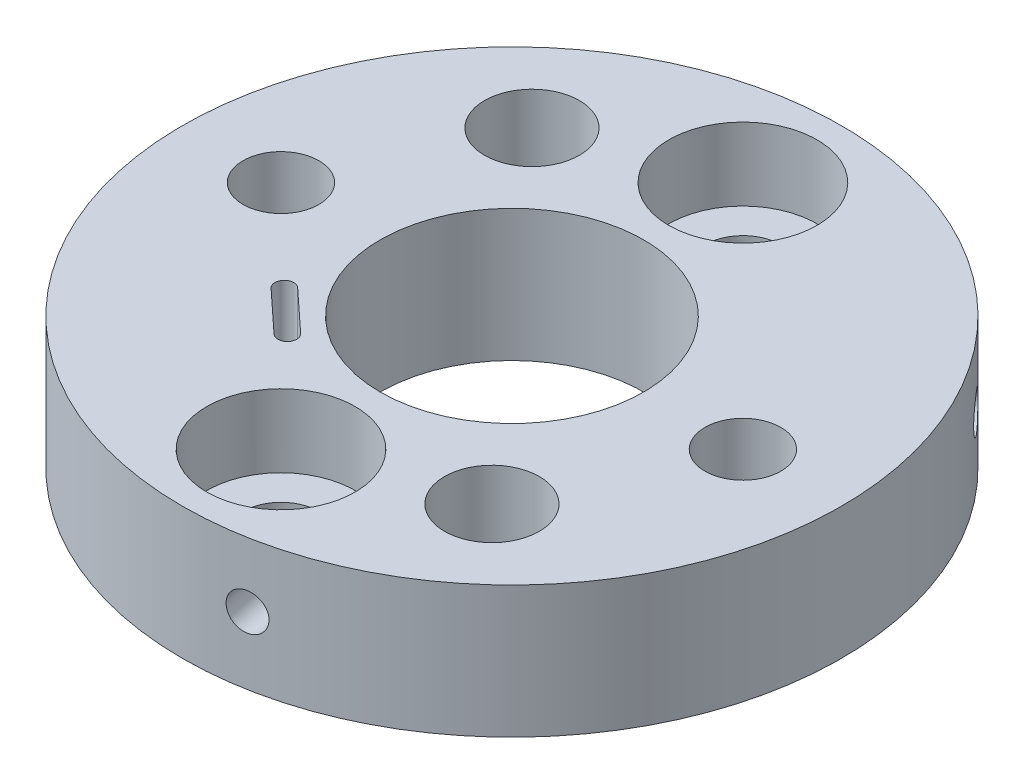
from build123d import *

# Parameters (mm, degrees)
SKETCH1_R                                      = 15.875
BOSS_EXTRUDE1_DEPTH                            = 6.35
SKETCH2_R                                      = 6.35
CUT_EXTRUDE1_DEPTH                             = 24.3313898
CBORE_FOR_6_SOCKET_HEAD_CAP_SCREW1_D           = 3.6576
CBORE_FOR_6_SOCKET_HEAD_CAP_SCREW1_CBORE_D     = 7.14502
CBORE_FOR_6_SOCKET_HEAD_CAP_SCREW1_CBORE_DEPTH = 3.5052
CIRPATTERN1_COUNT                              = 2
SKETCH11_R                                     = 2.286
CUT_EXTRUDE2_DEPTH                             = 24.3313898
CIRPATTERN3_COUNT                              = 2
CIRPATTERN4_COUNT                              = 3
CUT_EXTRUDE3_DEPTH                             = 24.331389963
CBORE_FOR_6_SOCKET_HEAD_CAP_SCREW2_D           = 3.6576
CBORE_FOR_6_SOCKET_HEAD_CAP_SCREW2_CBORE_D     = 7.14502
CBORE_FOR_6_SOCKET_HEAD_CAP_SCREW2_CBORE_DEPTH = 3.5052
CIRPATTERN5_COUNT                              = 2


with BuildPart() as part:
    # Sketch1 → Boss-Extrude1 (new body)
    with BuildSketch(Plane(origin=(0, 0, 0), x_dir=(1, 0, 0), z_dir=(0, 1, 0))):
        with Locations(Location((0, 0, 0), (0, 0, 270))):
            Circle(SKETCH1_R)
    extrude(amount=BOSS_EXTRUDE1_DEPTH)

    # Sketch2 → Cut-Extrude1 (cut, through all)
    with BuildSketch(Plane(origin=(0, 6.35, 0), x_dir=(1, 0, 0), z_dir=(0, 1, 0))):
        with Locations(Location((0, 0, 0), (0, 0, 270))):
            Circle(SKETCH2_R)
    extrude(amount=-CUT_EXTRUDE1_DEPTH, mode=Mode.SUBTRACT)

    # CBORE for #6 Socket Head Cap Screw1 (through all)
    with Locations(Plane(origin=(0, 6.35, 0), x_dir=(1, 0, 0), z_dir=(0, 1, 0))):
        with Locations((0, 11.1252)):
            cbore_for_6_socket_head_cap_screw1 = CounterBoreHole(CBORE_FOR_6_SOCKET_HEAD_CAP_SCREW1_D / 2, CBORE_FOR_6_SOCKET_HEAD_CAP_SCREW1_CBORE_D / 2, CBORE_FOR_6_SOCKET_HEAD_CAP_SCREW1_CBORE_DEPTH)

    # CirPattern1: CBORE for #6 Socket Head Cap Screw1 ×2 about axis
    cirpattern1_axis = Axis((0, 0, 0), (0, 1, 0))
    for i in range(1, CIRPATTERN1_COUNT):
        add(cbore_for_6_socket_head_cap_screw1.rotate(cirpattern1_axis, i * 360 / CIRPATTERN1_COUNT), mode=Mode.SUBTRACT)

    # Sketch11 → Cut-Extrude2 (cut, through all)
    with BuildSketch(Plane(origin=(0, 6.35, 0), x_dir=(1, 0, 0), z_dir=(0, 1, 0))):
        with Locations(Location((-7.360856908, 8.324988999, 0), (0, 0, 270))):
            Circle(SKETCH11_R)
    cut_extrude2 = extrude(amount=-CUT_EXTRUDE2_DEPTH, mode=Mode.SUBTRACT)

    # CirPattern3: Cut-Extrude2 ×2 about axis
    cirpattern3_axis = Axis((0, 0, 0), (0, 1, 0))
    for i in range(1, CIRPATTERN3_COUNT):
        add(cut_extrude2.rotate(cirpattern3_axis, i * 360 / CIRPATTERN3_COUNT), mode=Mode.SUBTRACT)

    # Sketch16 → Tap Drill for #2-56 Tap3 (revolve, cut)
    with BuildSketch(Plane(origin=(12.093135875, 3.244987275, -10.284536436), x_dir=(-0.6478448148472237, 0, -0.7617723386127685), z_dir=(0, 1, 0))):
        Polygon((0, 0), (0, 7.095959572), (0.889, 6.35), (0.889, 0), align=None)
    tap_drill_for_2_56_tap3 = revolve(axis=Axis((16.930390226, 3.244987275, -14.39835101), (-0.7617723386127686, 0, 0.6478448148472237)), mode=Mode.SUBTRACT)

    # CirPattern4: Tap Drill for #2-56 Tap3 ×3 about axis
    cirpattern4_axis = Axis((0, 6.35, 0), (0, -1, 0))
    for i in range(1, CIRPATTERN4_COUNT):
        add(tap_drill_for_2_56_tap3.rotate(cirpattern4_axis, i * 360 / CIRPATTERN4_COUNT), mode=Mode.SUBTRACT)

    # Sketch17 → Cut-Extrude3 (cut, through all)
    with BuildSketch(Plane(origin=(0, 6.35, 0), x_dir=(1, 0, 0), z_dir=(0, 1, 0))):
        with BuildLine():
            Line((-4.96914615, -6.489934512), (-6.955810814, -4.646503161))
            ThreePointArc((-6.955810814, -4.646503161), (-6.979764598, -4.005972756), (-6.339234193, -3.982018972))
            Line((-6.339234193, -3.982018972), (-4.352569529, -5.825450323))
            ThreePointArc((-4.352569529, -5.825450323), (-4.328615745, -6.465980728), (-4.96914615, -6.489934512))
        make_face()
    extrude(amount=-CUT_EXTRUDE3_DEPTH, mode=Mode.SUBTRACT)

    # CBORE for #6 Socket Head Cap Screw2 (through all)
    with Locations(Plane(origin=(11.1252, 0, 0), x_dir=(0, 0, -1), z_dir=(0, -1, 0))):
        with Locations((0, 0)):
            cbore_for_6_socket_head_cap_screw2 = CounterBoreHole(CBORE_FOR_6_SOCKET_HEAD_CAP_SCREW2_D / 2, CBORE_FOR_6_SOCKET_HEAD_CAP_SCREW2_CBORE_D / 2, CBORE_FOR_6_SOCKET_HEAD_CAP_SCREW2_CBORE_DEPTH)

    # CirPattern5: CBORE for #6 Socket Head Cap Screw2 ×2 about axis
    cirpattern5_axis = Axis((0, 0, 0), (0, 1, 0))
    for i in range(1, CIRPATTERN5_COUNT):
        add(cbore_for_6_socket_head_cap_screw2.rotate(cirpattern5_axis, i * 360 / CIRPATTERN5_COUNT), mode=Mode.SUBTRACT)


solid = part.part
